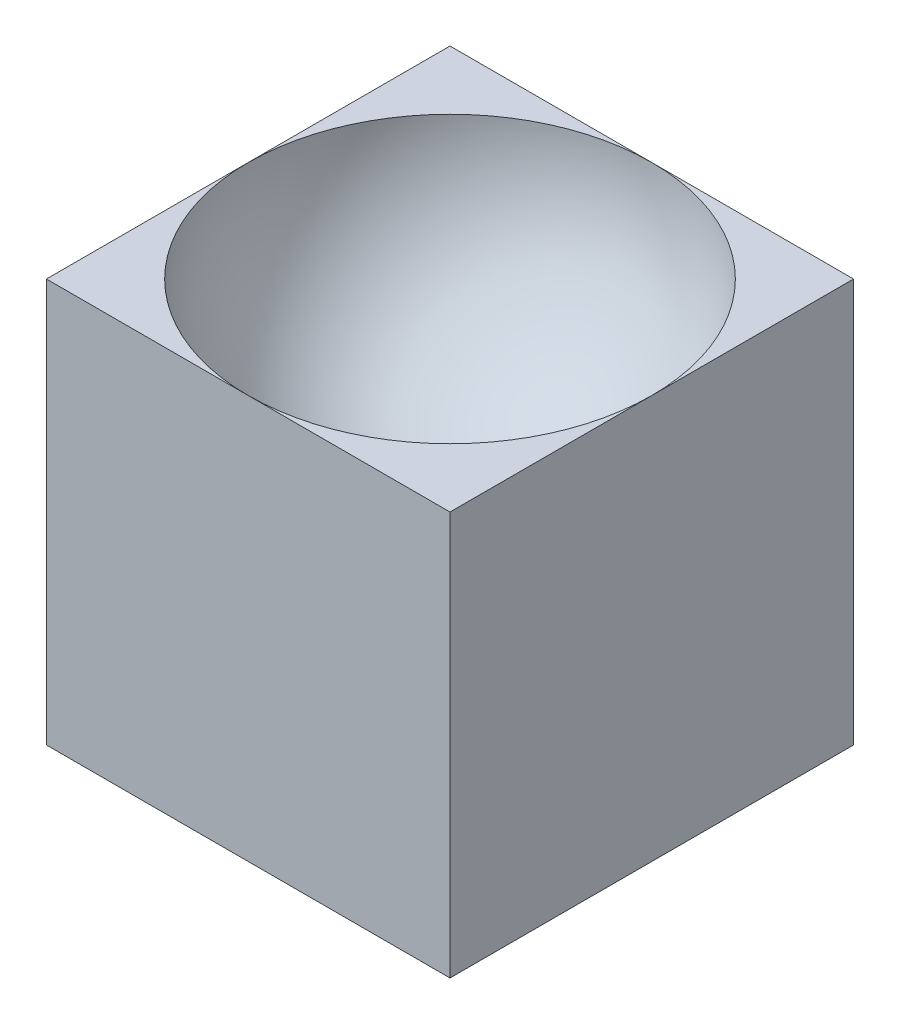
from build123d import *

# Parameters (mm, degrees)
SKETCH1_W           = 2
SKETCH1_H           = 2
BOSS_EXTRUDE1_DEPTH = 2


with BuildPart() as part:
    # Sketch1 → Boss-Extrude1 (new body)
    with BuildSketch(Plane(origin=(0, 0, 0), x_dir=(1, 0, 0), z_dir=(0, 1, 0))):
        Rectangle(SKETCH1_W, SKETCH1_H)
    extrude(amount=BOSS_EXTRUDE1_DEPTH)

    # Sketch2 → Cut-Revolve1 (revolve, cut)
    with BuildSketch(Plane(origin=(0, 2, 0), x_dir=(1, 0, 0), z_dir=(0, 1, 0))):
        with BuildLine():
            Line((0, -1), (0, 1))
            ThreePointArc((0, 1), (-1, 0), (0, -1))
        make_face()
    revolve(axis=Axis((0, 2, -1), (0, 0, 1)), mode=Mode.SUBTRACT)


solid = part.part
